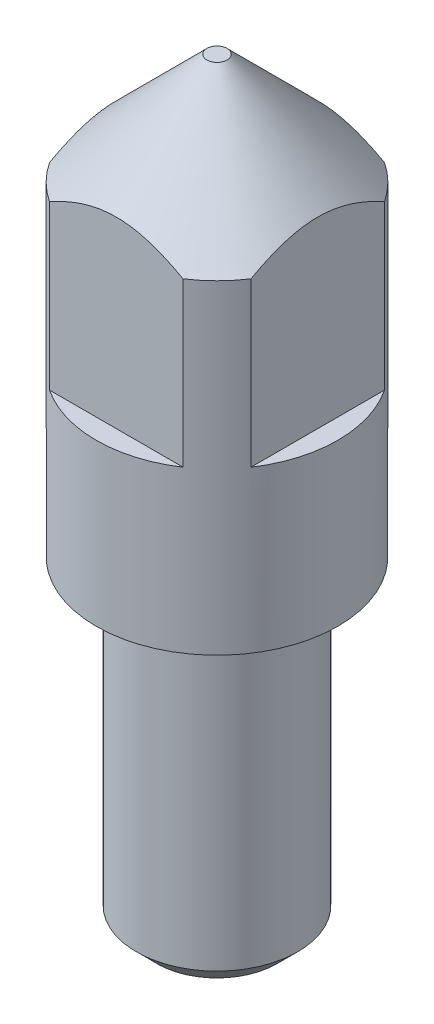
from build123d import *

# Parameters (mm, degrees)
CHAMFER1_SIZE       = 2.75
SKETCH2_OUTSIDE_W   = 12.126
SKETCH2_OUTSIDE_H   = 12.126
SKETCH2_OUTSIDE_W_2 = 5
SKETCH2_OUTSIDE_H_2 = 5
CUT_EXTRUDE1_DEPTH  = 6.8
CHAMFER2_SIZE       = 0.5


with BuildPart() as part:
    # Sketch1 → Revolve1 (revolve)
    with BuildSketch(Plane.XY, mode=Mode.PRIVATE) as revolve1_sk:
        Polygon((0, -8), (2, -8), (2, 0), (3, 0), (3, 10.8), (0, 10.8), align=None)
    revolve(revolve1_sk.sketch.rotate(Axis((0, -10.593240764, 0), (0, 1, 0)), 90), axis=Axis((0, -10.593240764, 0), (0, 1, 0)))

    # Chamfer1
    chamfer1_edges = [part.edges().sort_by_distance(p)[0] for p in [
        (0, 10.8, 3),
    ]]
    chamfer(chamfer1_edges, length=CHAMFER1_SIZE)

    # Sketch2 outside → Cut-Extrude1 (cut)
    with BuildSketch(Plane(origin=(0, 10.8, 0), x_dir=(1, 0, 0), z_dir=(0, 1, 0))):
        Rectangle(SKETCH2_OUTSIDE_W, SKETCH2_OUTSIDE_H)
        Rectangle(SKETCH2_OUTSIDE_W_2, SKETCH2_OUTSIDE_H_2, mode=Mode.SUBTRACT)
    extrude(amount=-CUT_EXTRUDE1_DEPTH, mode=Mode.SUBTRACT)

    # Chamfer2
    chamfer2_edges = [part.edges().sort_by_distance(p)[0] for p in [
        (0, -8, 2),
    ]]
    chamfer(chamfer2_edges, length=CHAMFER2_SIZE)


solid = part.part
